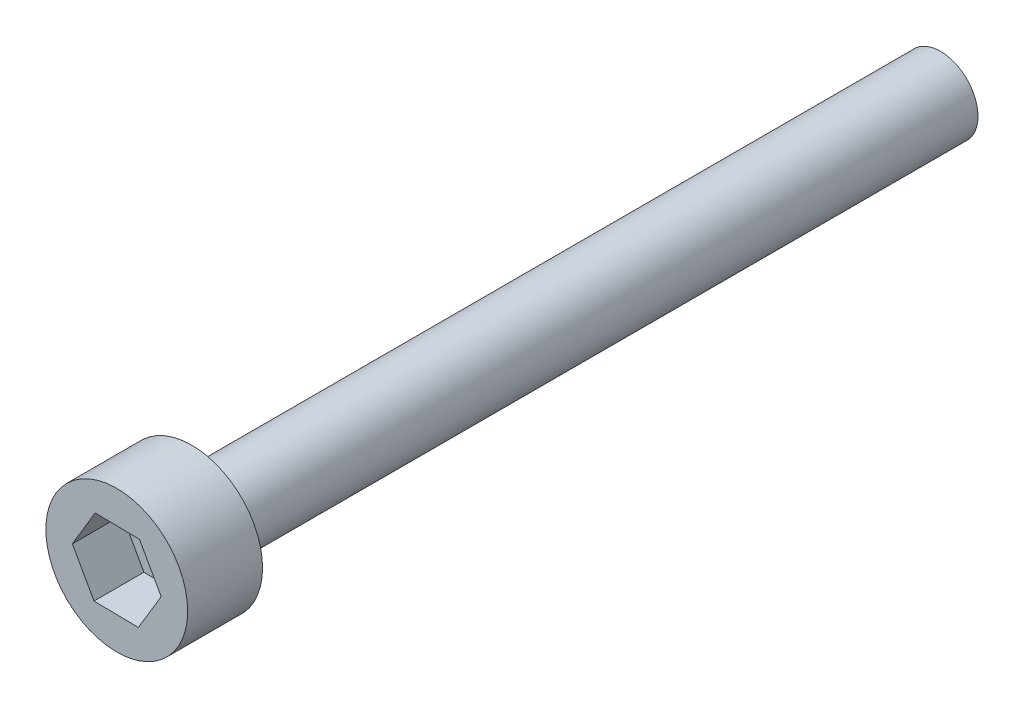
from build123d import *

# Parameters (mm, degrees)
SKETCH_1_R          = 2.84
EXTRUDE_1_DEPTH     = 3
SKETCH_2_R          = 1.5
EXTRUDE_2_DEPTH     = 30
CUT_EXTRUDE_1_DEPTH = 2


with BuildPart() as part:
    # 草图1 → 凸台-拉伸1 (new body)
    with BuildSketch(Plane.XY):
        Circle(SKETCH_1_R)
    extrude(amount=EXTRUDE_1_DEPTH)

    # 草图2 → 凸台-拉伸2 (add)
    with BuildSketch(Plane(origin=(0, 0, 0), x_dir=(-1, 0, 0), z_dir=(0, 0, -1))):
        with Locations(Location((0, 0, 0), (0, 0, 180))):
            Circle(SKETCH_2_R)
    extrude(amount=EXTRUDE_2_DEPTH)

    # 草图3 → 切除-拉伸1 (cut)
    with BuildSketch(Plane.XY.offset(3)):
        Polygon((0.912581429, 1.526213769), (-0.865449181, 1.553425585), (-1.77803061, 0.027211816), (-0.912581429, -1.526213769), (0.865449181, -1.553425585), (1.77803061, -0.027211816), align=None)
    extrude(amount=-CUT_EXTRUDE_1_DEPTH, mode=Mode.SUBTRACT)


solid = part.part
